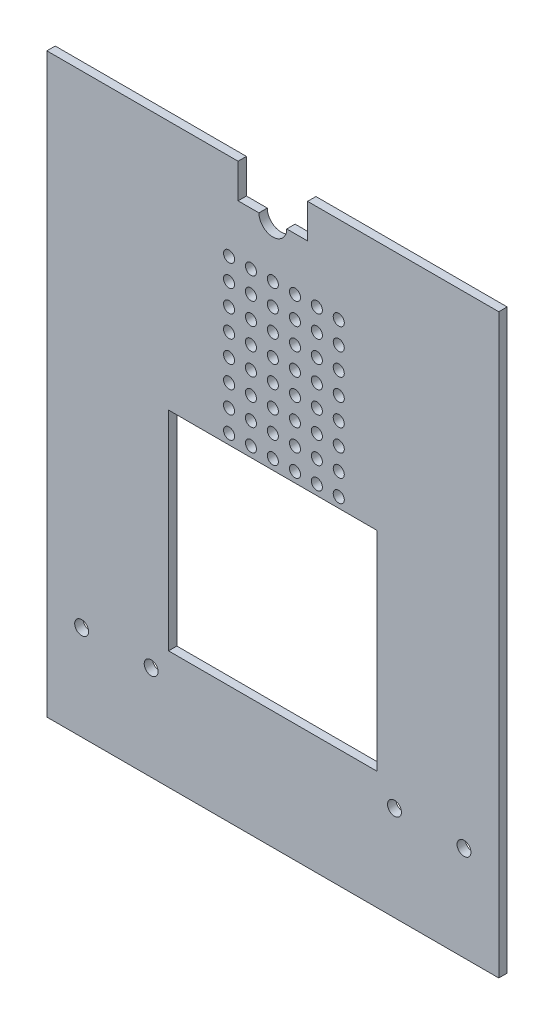
from build123d import *

# Parameters (mm, degrees)
SKETCH1_W           = 165.1
SKETCH1_H           = 292.1
BOSS_EXTRUDE1_DEPTH = 3.048
SKETCH2_R           = 10.7315
SKETCH2_R_2         = 2.0193
SKETCH2_W           = 16.173788568
SKETCH2_H           = 32.6898
SKETCH2_W_2         = 76.2
SKETCH2_H_2         = 76.2
CUT_EXTRUDE1_DEPTH  = 168.792715289
CUT_EXTRUDE2_DEPTH  = 168.792715289
SKETCH5_R           = 2.54
CUT_EXTRUDE3_DEPTH  = 168.792715289
SKETCH6_W           = 165.1
SKETCH6_H           = 5.08
CUT_EXTRUDE4_DEPTH  = 168.792715289
CUT_EXTRUDE5_REACH  = 165.39
SKETCH7_R           = 5.08


with BuildPart() as part:
    # Sketch1 → Boss-Extrude1 (new body)
    with BuildSketch(Plane.XY):
        Rectangle(SKETCH1_W, SKETCH1_H)
    extrude(amount=BOSS_EXTRUDE1_DEPTH)

    # Sketch2 → Cut-Extrude1 (cut, through all)
    with BuildSketch(Plane.XY):
        with Locations((0, 92.71)):
            Circle(SKETCH2_R)
        with Locations(Location((0, 38.1, 0), (0, 0, 180))):
            Circle(SKETCH2_R_2)
        with Locations(Location((0, 30.1, 0), (0, 0, 180))):
            Circle(SKETCH2_R_2)
        with Locations(Location((0, 22.1, 0), (0, 0, 180))):
            Circle(SKETCH2_R_2)
        with Locations(Location((0, 14.1, 0), (0, 0, 180))):
            Circle(SKETCH2_R_2)
        with Locations(Location((0, 6.1, 0), (0, 0, 180))):
            Circle(SKETCH2_R_2)
        with Locations(Location((0, -1.9, 0), (0, 0, 180))):
            Circle(SKETCH2_R_2)
        with Locations(Location((0, -9.9, 0), (0, 0, 180))):
            Circle(SKETCH2_R_2)
        with Locations(Location((0, -17.9, 0), (0, 0, 180))):
            Circle(SKETCH2_R_2)
        with Locations(Location((-8, 38.1, 0), (0, 0, 180))):
            Circle(SKETCH2_R_2)
        with Locations(Location((-16, 38.1, 0), (0, 0, 180))):
            Circle(SKETCH2_R_2)
        with Locations(Location((-8, 30.1, 0), (0, 0, 180))):
            Circle(SKETCH2_R_2)
        with Locations(Location((-16, 30.1, 0), (0, 0, 180))):
            Circle(SKETCH2_R_2)
        with Locations(Location((-8, 22.1, 0), (0, 0, 180))):
            Circle(SKETCH2_R_2)
        with Locations(Location((-16, 22.1, 0), (0, 0, 180))):
            Circle(SKETCH2_R_2)
        with Locations(Location((-8, 14.1, 0), (0, 0, 180))):
            Circle(SKETCH2_R_2)
        with Locations(Location((-16, 14.1, 0), (0, 0, 180))):
            Circle(SKETCH2_R_2)
        with Locations(Location((-8, 6.1, 0), (0, 0, 180))):
            Circle(SKETCH2_R_2)
        with Locations(Location((-16, 6.1, 0), (0, 0, 180))):
            Circle(SKETCH2_R_2)
        with Locations(Location((-8, -1.9, 0), (0, 0, 180))):
            Circle(SKETCH2_R_2)
        with Locations(Location((-16, -1.9, 0), (0, 0, 180))):
            Circle(SKETCH2_R_2)
        with Locations(Location((-8, -9.9, 0), (0, 0, 180))):
            Circle(SKETCH2_R_2)
        with Locations(Location((-16, -9.9, 0), (0, 0, 180))):
            Circle(SKETCH2_R_2)
        with Locations(Location((-8, -17.9, 0), (0, 0, 180))):
            Circle(SKETCH2_R_2)
        with Locations(Location((-16, -17.9, 0), (0, 0, 180))):
            Circle(SKETCH2_R_2)
        with Locations(Location((24.086894284, 14.1, 0), (0, 0, 180))):
            Circle(SKETCH2_R_2)
        with Locations(Location((8.086894284, 14.1, 0), (0, 0, 180))):
            Circle(SKETCH2_R_2)
        with Locations(Location((8.086894284, -17.9, 0), (0, 0, 180))):
            Circle(SKETCH2_R_2)
        with Locations(Location((24.086894284, 6.1, 0), (0, 0, 180))):
            Circle(SKETCH2_R_2)
        with Locations(Location((16.086894284, 6.1, 0), (0, 0, 180))):
            Circle(SKETCH2_R_2)
        with Locations(Location((8.086894284, -1.9, 0), (0, 0, 180))):
            Circle(SKETCH2_R_2)
        with Locations(Location((8.086894284, 30.1, 0), (0, 0, 180))):
            Circle(SKETCH2_R_2)
        with Locations(Location((24.086894284, 22.1, 0), (0, 0, 180))):
            Circle(SKETCH2_R_2)
        with Locations(Location((24.086894284, -1.9, 0), (0, 0, 180))):
            Circle(SKETCH2_R_2)
        with Locations(Location((24.086894284, -9.9, 0), (0, 0, 180))):
            Circle(SKETCH2_R_2)
        with Locations(Location((8.086894284, 6.1, 0), (0, 0, 180))):
            Circle(SKETCH2_R_2)
        with Locations(Location((16.086894284, 22.1, 0), (0, 0, 180))):
            Circle(SKETCH2_R_2)
        with Locations(Location((8.086894284, 22.1, 0), (0, 0, 180))):
            Circle(SKETCH2_R_2)
        with Locations(Location((8.086894284, -9.9, 0), (0, 0, 180))):
            Circle(SKETCH2_R_2)
        with Locations(Location((24.086894284, -17.9, 0), (0, 0, 180))):
            Circle(SKETCH2_R_2)
        with Locations(Location((16.086894284, 14.1, 0), (0, 0, 180))):
            Circle(SKETCH2_R_2)
        with Locations(Location((16.086894284, -17.9, 0), (0, 0, 180))):
            Circle(SKETCH2_R_2)
        with Locations(Location((16.086894284, 30.1, 0), (0, 0, 180))):
            Circle(SKETCH2_R_2)
        with Locations(Location((24.086894284, 30.1, 0), (0, 0, 180))):
            Circle(SKETCH2_R_2)
        with Locations(Location((16.086894284, -9.9, 0), (0, 0, 180))):
            Circle(SKETCH2_R_2)
        with Locations(Location((16.086894284, -1.9, 0), (0, 0, 180))):
            Circle(SKETCH2_R_2)
        with Locations(Location((16.086894284, 38.1, 0), (0, 0, 180))):
            Circle(SKETCH2_R_2)
        with Locations(Location((8.086894284, 38.1, 0), (0, 0, 180))):
            Circle(SKETCH2_R_2)
        with Locations(Location((24.086894284, 38.1, 0), (0, 0, 180))):
            Circle(SKETCH2_R_2)
        with Locations((0, 92.71)):
            Rectangle(SKETCH2_W, SKETCH2_H)
        with Locations((0, -59.69)):
            Rectangle(SKETCH2_W_2, SKETCH2_H_2)
    extrude(amount=CUT_EXTRUDE1_DEPTH, mode=Mode.SUBTRACT)

    # Sketch4 → Cut-Extrude2 (cut, through all)
    with BuildSketch(Plane.XY):
        Polygon((-12.7, 57.310847547), (-12.7, 69.85), (-82.55, 69.85), (-82.55, 146.05), (82.55, 146.05), (82.55, 69.85), (12.7, 69.85), (12.7, 57.310847547), align=None)
    extrude(amount=CUT_EXTRUDE2_DEPTH, mode=Mode.SUBTRACT)

    # Sketch5 → Cut-Extrude3 (cut, through all)
    with BuildSketch(Plane(origin=(0, 0, 0), x_dir=(-1, 0, 0), z_dir=(0, 0, -1))):
        with Locations((-44.45, -106.299)):
            Circle(SKETCH5_R)
        with Locations((-69.85, -106.299)):
            Circle(SKETCH5_R)
        with Locations((69.85, -106.299)):
            Circle(SKETCH5_R)
        with Locations((44.45, -106.299)):
            Circle(SKETCH5_R)
    extrude(amount=-CUT_EXTRUDE3_DEPTH, mode=Mode.SUBTRACT)

    # Sketch6 → Cut-Extrude4 (cut, through all)
    with BuildSketch(Plane(origin=(0, 0, 0), x_dir=(-1, 0, 0), z_dir=(0, 0, -1))):
        with Locations((0, -143.51)):
            Rectangle(SKETCH6_W, SKETCH6_H)
    extrude(amount=-CUT_EXTRUDE4_DEPTH, mode=Mode.SUBTRACT)

    # Sketch7 → Cut-Extrude5 (cut, up to next)
    with BuildSketch(Plane.XY.offset(3.048), mode=Mode.PRIVATE) as cut_extrude5_sk1:
        with Locations((0, 57.310847547)):
            Circle(SKETCH7_R)
    cut_extrude5_tool1 = extrude(cut_extrude5_sk1.sketch, amount=-CUT_EXTRUDE5_REACH, mode=Mode.PRIVATE) & part.part
    add(cut_extrude5_tool1.solids().sort_by_distance((0, 57.310848, 3.048))[0], mode=Mode.SUBTRACT)


solid = part.part
